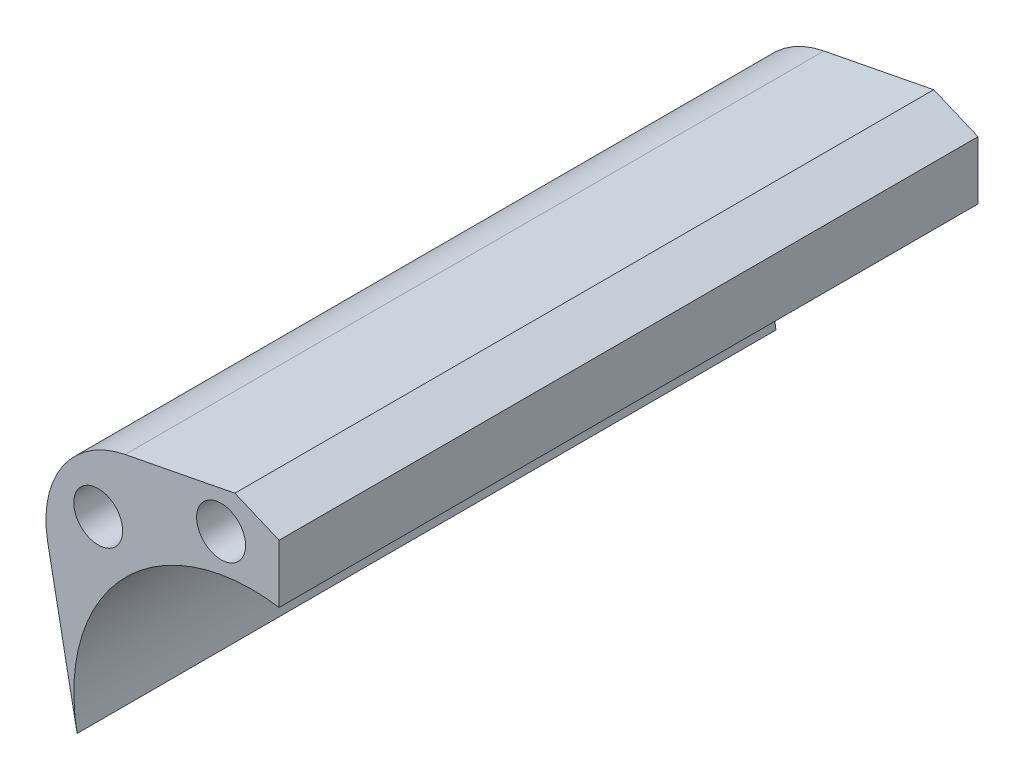
from build123d import *

# Parameters (mm, degrees)
SKETCH1_R           = 1.75
BOSS_EXTRUDE1_DEPTH = 50


with BuildPart() as part:
    # Sketch1 → Boss-Extrude1 (new body)
    with BuildSketch(Plane.XY):
        with BuildLine():
            Line((-1.227746263, 18.098484442), (-9.080608035, 16.571211715))
            ThreePointArc((-9.080608035, 16.571211715), (-13.547906523, 13.61371621), (-14.61549845, 8.363594028))
            Line((-14.61549845, 8.363594028), (-12.51549845, -2.434090909))
            ThreePointArc((-12.51549845, -2.434090909), (-9.191490994, 8.83623185), (1.939125087, 12.601678218))
            Line((1.939125087, 12.601678218), (1.939125087, 16.770805726))
            Line((1.939125087, 16.770805726), (-1.227746263, 18.098484442))
        make_face()
        with Locations((-2.214014265, 15.234848079)):
            Circle(SKETCH1_R, mode=Mode.SUBTRACT)
        with Locations((-11.005882474, 11.750641074)):
            Circle(SKETCH1_R, mode=Mode.SUBTRACT)
    extrude(amount=BOSS_EXTRUDE1_DEPTH)


solid = part.part
